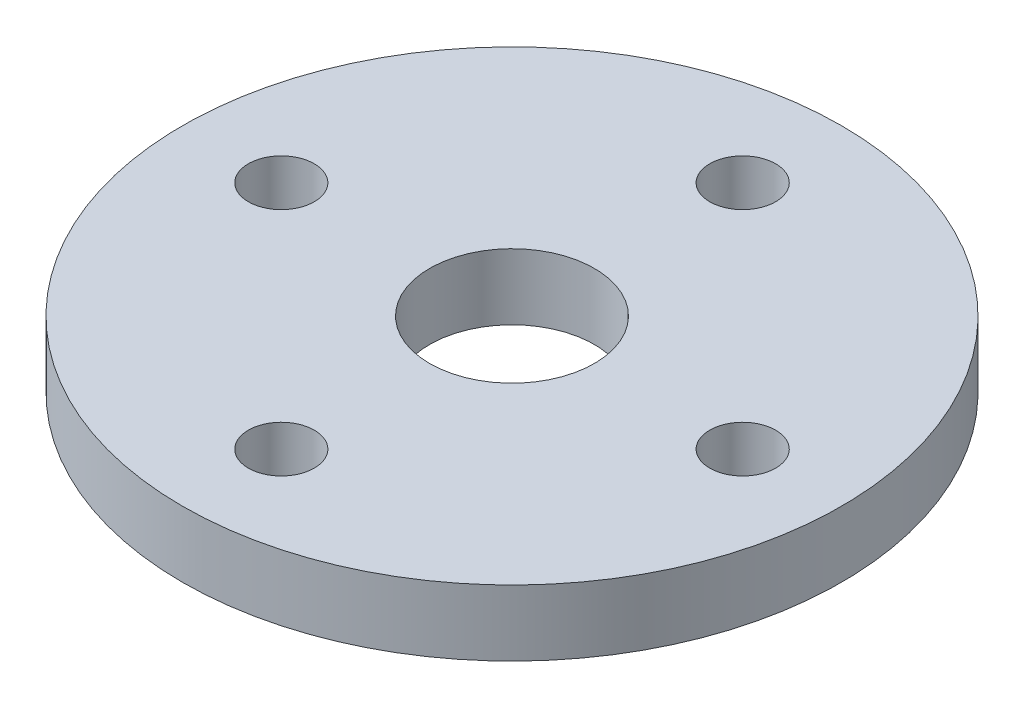
from build123d import *

# Parameters (mm, degrees)
SKETCH1_R           = 10
BOSS_EXTRUDE1_DEPTH = 2
SKETCH2_R           = 2.5
CUT_EXTRUDE1_DEPTH  = 2
SKETCH3_R           = 1
CUT_EXTRUDE2_DEPTH  = 2


with BuildPart() as part:
    # Sketch1 → Boss-Extrude1 (new body)
    with BuildSketch(Plane(origin=(0, 0, 0), x_dir=(1, 0, 0), z_dir=(0, 1, 0))):
        with Locations(Location((0, 0, 0), (0, 0, 270))):
            Circle(SKETCH1_R)
    extrude(amount=BOSS_EXTRUDE1_DEPTH)

    # Sketch2 → Cut-Extrude1 (cut)
    with BuildSketch(Plane(origin=(0, 2, 0), x_dir=(1, 0, 0), z_dir=(0, 1, 0))):
        with Locations(Location((0, 0, 0), (0, 0, 270))):
            Circle(SKETCH2_R)
    extrude(amount=-CUT_EXTRUDE1_DEPTH, mode=Mode.SUBTRACT)

    # Sketch3 → Cut-Extrude2 (cut)
    with BuildSketch(Plane(origin=(0, 2, 0), x_dir=(1, 0, 0), z_dir=(0, 1, 0))):
        with Locations(Location((7, 0, 0), (0, 0, 270))):
            Circle(SKETCH3_R)
        with Locations(Location((0, -7, 0), (0, 0, 270))):
            Circle(SKETCH3_R)
        with Locations(Location((-7, 0, 0), (0, 0, 270))):
            Circle(SKETCH3_R)
        with Locations(Location((0, 7, 0), (0, 0, 270))):
            Circle(SKETCH3_R)
    extrude(amount=-CUT_EXTRUDE2_DEPTH, mode=Mode.SUBTRACT)


solid = part.part
